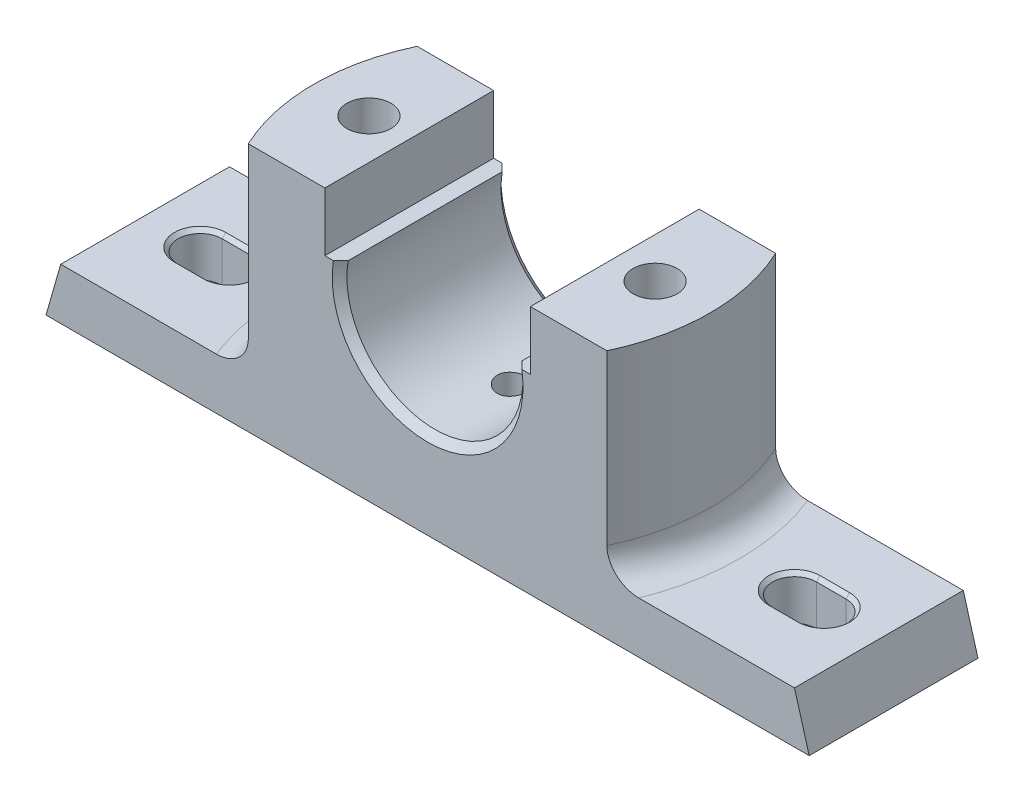
from build123d import *

# Parameters (mm, degrees)
BOSS_EXTRUDE1_DEPTH     = 46
BOSS_EXTRUDE2_DEPTH     = 54
CUT_EXTRUDE1_DEPTH      = 133.4990566
CUT_EXTRUDE1_DEPTH_BACK = 133.4990566
CUT_EXTRUDE2_DEPTH      = 126.888839855
CUT_EXTRUDE2_DEPTH_BACK = 126.888839855
F_12_0MM_DOWEL_HOLE1_D  = 12
SKETCH14_W              = 28
SKETCH14_H              = 28
SKETCH14_R              = 6
CUT_EXTRUDE5_DEPTH      = 10
SKETCH15_R              = 4
CUT_EXTRUDE6_DEPTH      = 54
CUT_EXTRUDE7_DEPTH      = 21
CHAMFER2_SIZE           = 2
FILLET1_R               = 8
CHAMFER3_SIZE           = 1


with BuildPart() as part:
    # Sketch1 → Boss-Extrude1 (new body)
    with BuildSketch(Plane.XY):
        Polygon((-104, 0), (104, 0), (99.985564599, 14), (-99.985564599, 14), align=None)
    extrude(amount=BOSS_EXTRUDE1_DEPTH)

    # Sketch2 → Boss-Extrude2 (add)
    with BuildSketch(Plane(origin=(0, 14, 0), x_dir=(1, 0, 0), z_dir=(0, 1, 0))):
        with BuildLine():
            Line((-48.856934001, 0), (48.856934001, 0))
            ThreePointArc((48.856934001, 0), (54, -23), (48.856934001, -46))
            Line((48.856934001, -46), (-48.856934001, -46))
            ThreePointArc((-48.856934001, -46), (-54, -23), (-48.856934001, 0))
        make_face()
    extrude(amount=BOSS_EXTRUDE2_DEPTH)

    # Sketch3 → Cut-Extrude1 (cut, two sides: drawn at the far end of the back side and taken through both)
    with BuildSketch(Plane.XY.offset(46).offset(-CUT_EXTRUDE1_DEPTH_BACK)):
        with BuildLine():
            Line((28, 52), (28, 68))
            Line((28, 68), (-28, 68))
            Line((-28, 68), (-28, 52))
            Line((-28, 52), (-23.664319132, 52))
            ThreePointArc((-23.664319132, 52), (0, 24), (23.664319132, 52))
            Line((23.664319132, 52), (28, 52))
        make_face()
    extrude(amount=CUT_EXTRUDE1_DEPTH + CUT_EXTRUDE1_DEPTH_BACK, mode=Mode.SUBTRACT)

    # Sketch4 → Cut-Extrude2 (cut, two sides: drawn at the far end of the back side and taken through both)
    with BuildSketch(Plane(origin=(0, 14, 0), x_dir=(1, 0, 0), z_dir=(0, 1, 0)).offset(-CUT_EXTRUDE2_DEPTH_BACK)):
        with BuildLine():
            Line((77, -17), (85, -17))
            ThreePointArc((85, -17), (91, -23), (85, -29))
            Line((85, -29), (77, -29))
            ThreePointArc((77, -29), (71, -23), (77, -17))
        make_face()
        with BuildLine():
            Line((-77, -17), (-85, -17))
            ThreePointArc((-85, -17), (-91, -23), (-85, -29))
            Line((-85, -29), (-77, -29))
            ThreePointArc((-77, -29), (-71, -23), (-77, -17))
        make_face()
    extrude(amount=CUT_EXTRUDE2_DEPTH + CUT_EXTRUDE2_DEPTH_BACK, mode=Mode.SUBTRACT)

    # Ø12.0mm Dowel Hole1 (through all)
    with Locations(Plane(origin=(0, 68, 0), x_dir=(1, 0, 0), z_dir=(0, 1, 0))):
        with Locations((39, -23)):
            f_12_0mm_dowel_hole1 = Hole(F_12_0MM_DOWEL_HOLE1_D / 2)

    # Mirror1: Ø12.0mm Dowel Hole1 across plane
    add(f_12_0mm_dowel_hole1.mirror(Plane(origin=(0, 0, 0), x_dir=(0, 0, 1), z_dir=(1, 0, 0))), mode=Mode.SUBTRACT)

    # Sketch14 → Cut-Extrude5 (cut)
    # profile 1 of 2: a face of its own
    with BuildSketch(Plane.XZ):
        with Locations((-39, 23)):
            Rectangle(SKETCH14_W, SKETCH14_H)
        with Locations(Location((-39, 23, 0), (0, 0, 90))):
            Circle(SKETCH14_R, mode=Mode.SUBTRACT)
    # profile 2 of 2: a face of its own
    with BuildSketch(Plane.XZ):
        with Locations((39, 23)):
            Rectangle(SKETCH14_W, SKETCH14_H)
        with Locations(Location((39, 23, 0), (0, 0, 90))):
            Circle(SKETCH14_R, mode=Mode.SUBTRACT)
    extrude(amount=-CUT_EXTRUDE5_DEPTH, mode=Mode.SUBTRACT)

    # Sketch15 → Cut-Extrude6 (cut)
    with BuildSketch(Plane(origin=(0, 68, 0), x_dir=(1, 0, 0), z_dir=(0, 1, 0))):
        with Locations(Location((0, -23, 0), (0, 0, 180))):
            Circle(SKETCH15_R)
    extrude(amount=-CUT_EXTRUDE6_DEPTH, mode=Mode.SUBTRACT)

    # Sketch18 → Cut-Extrude7 (cut, symmetric)
    with BuildSketch(Plane.XY.offset(23)):
        Polygon((-97.5, 0), (-96.926509228, 2), (96.926509228, 2), (97.5, 0), align=None)
    extrude(amount=CUT_EXTRUDE7_DEPTH, both=True, mode=Mode.SUBTRACT)

    # Chamfer2
    chamfer2_edges = [part.edges().sort_by_distance(p)[0] for p in [
        (0, 24, 0),
        (0, 24, 46),
    ]]
    chamfer(chamfer2_edges, length=CHAMFER2_SIZE)

    # Fillet1
    fillet1_edges = [part.edges().sort_by_distance(p)[0] for p in [
        (54, 14, 23),
        (-54, 14, 23),
    ]]
    fillet(fillet1_edges, radius=FILLET1_R)

    # Chamfer3
    chamfer3_edges = [part.edges().sort_by_distance(p)[0] for p in [
        (-71, 14, 23),
        (-81, 14, 29),
        (-91, 14, 23),
        (-81, 14, 17),
        (81, 14, 17),
        (81, 14, 29),
        (91, 14, 23),
        (71, 14, 23),
    ]]
    chamfer(chamfer3_edges, length=CHAMFER3_SIZE)


solid = part.part
